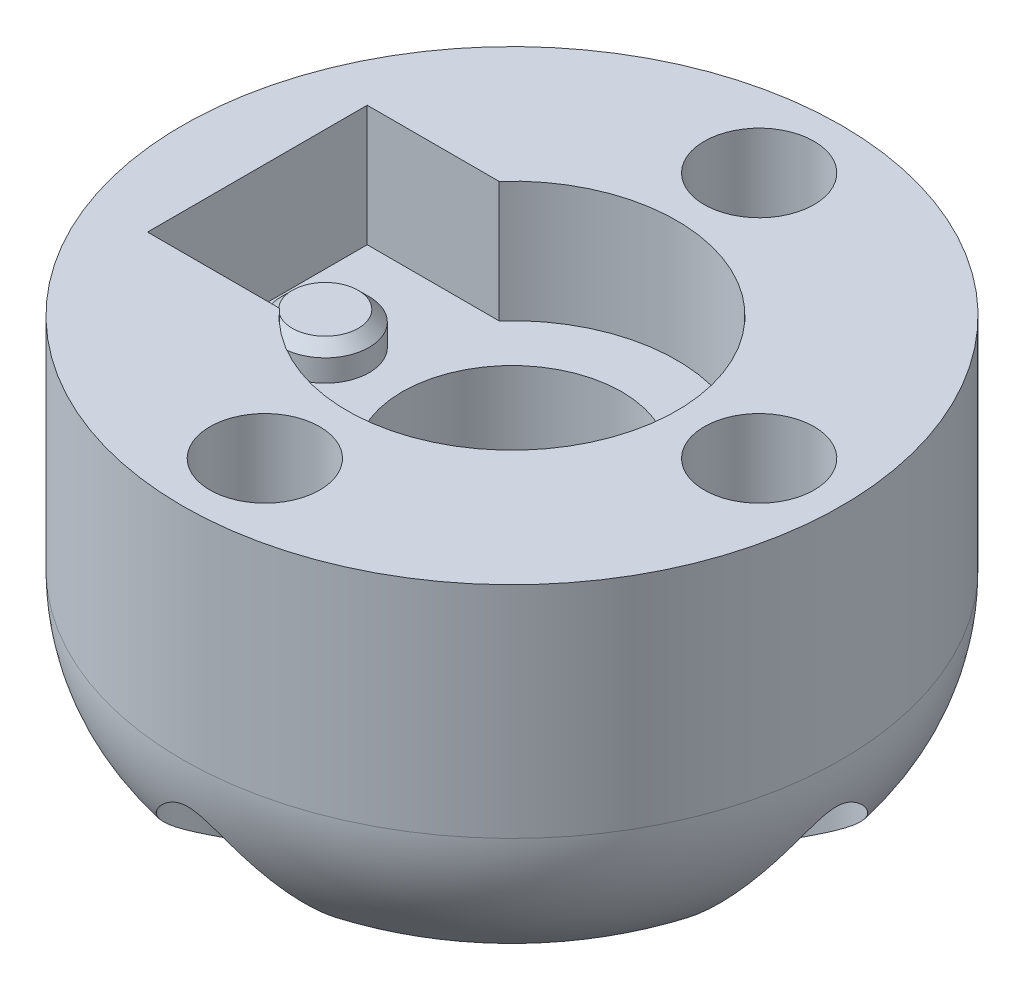
from build123d import *

# Parameters (mm, degrees)
SKETCH1_R             = 15
SKETCH1_R_2           = 5
BOSS_EXTRUDE1_DEPTH   = 7.5
SKETCH2_R             = 15
SKETCH2_R_2           = 7.5
BOSS_EXTRUDE2_DEPTH   = 5.5
BOSS_EXTRUDE3_START   = 5
SKETCH3_R             = 15
BOSS_EXTRUDE3_DEPTH   = 5
M4X0_7_TAPPED_HOLE1_D = 3.3
FILLET1_R             = 8
HOLE1_D               = 5
HOLE1_DEPTH           = 18
HOLE1_CBORE_D         = 7
HOLE1_CBORE_DEPTH     = 7
HOLE1_TIP             = 1.502151548
CUT_EXTRUDE1_START    = -5.5
CUT_EXTRUDE1_DEPTH    = 5.5
SKETCH10_R            = 2
BOSS_EXTRUDE4_DEPTH   = 1.5
CHAMFER1_SIZE         = 0.5


with BuildPart() as part:
    # Sketch1 → Boss-Extrude1 (new body)
    with BuildSketch(Plane(origin=(0, 0, 0), x_dir=(1, 0, 0), z_dir=(0, 1, 0))):
        with Locations(Location((0, 0, 0), (0, 0, 270))):
            Circle(SKETCH1_R)
        with Locations(Location((0, 0, 0), (0, 0, 270))):
            Circle(SKETCH1_R_2, mode=Mode.SUBTRACT)
    extrude(amount=BOSS_EXTRUDE1_DEPTH)

    # Sketch2 → Boss-Extrude2 (add)
    with BuildSketch(Plane(origin=(0, 7.5, 0), x_dir=(1, 0, 0), z_dir=(0, 1, 0))):
        with Locations(Location((0, 0, 0), (0, 0, 270))):
            Circle(SKETCH2_R)
        with Locations(Location((0, 0, 0), (0, 0, 270))):
            Circle(SKETCH2_R_2, mode=Mode.SUBTRACT)
    extrude(amount=BOSS_EXTRUDE2_DEPTH)

    # Sketch3 → Boss-Extrude3 (add)
    with BuildSketch(Plane.XZ.offset(BOSS_EXTRUDE3_START)):
        with Locations(Location((0, 0, 0), (0, 0, 270))):
            Circle(SKETCH3_R)
    extrude(amount=-BOSS_EXTRUDE3_DEPTH)

    # M4x0.7 Tapped Hole1 (through all)
    with Locations(Plane(origin=(0, -5, 0), x_dir=(-1, 0, 0), z_dir=(0, -1, 0))):
        with Locations((0, 0)):
            Hole(M4X0_7_TAPPED_HOLE1_D / 2)

    # Fillet1
    fillet1_edges = [part.edges().sort_by_distance(p)[0] for p in [
        (0, -5, 15),
    ]]
    fillet(fillet1_edges, radius=FILLET1_R)

    # Hole1
    with Locations(Plane(origin=(0, -5, 0), x_dir=(-1, 0, 0), z_dir=(0, -1, 0))):
        with Locations((0, 11.25), (-11.25, 0), (0, -11.25)):
            CounterBoreHole(HOLE1_D / 2, HOLE1_CBORE_D / 2, HOLE1_CBORE_DEPTH, depth=HOLE1_DEPTH)
            with Locations((0, 0, -(HOLE1_DEPTH + HOLE1_TIP / 2))):  # 118° drill point
                Cone(0, HOLE1_D / 2, HOLE1_TIP, mode=Mode.SUBTRACT)

    # Sketch9 → Cut-Extrude1 (cut)
    with BuildSketch(Plane(origin=(0, 13, 0), x_dir=(1, 0, 0), z_dir=(0, 1, 0)).offset(CUT_EXTRUDE1_START)):
        with BuildLine():
            Line((-5.590169944, 5), (-11.590169944, 5))
            Line((-11.590169944, 5), (-11.590169944, -5))
            Line((-11.590169944, -5), (-5.590169944, -5))
            ThreePointArc((-5.590169944, -5), (-7.5, 0), (-5.590169944, 5))
        make_face()
    extrude(amount=CUT_EXTRUDE1_DEPTH, mode=Mode.SUBTRACT)

    # Sketch10 → Boss-Extrude4 (add)
    with BuildSketch(Plane(origin=(0, 7.5, 0), x_dir=(1, 0, 0), z_dir=(0, 1, 0))):
        with Locations(Location((-8.5, 0, 0), (0, 0, 270))):
            Circle(SKETCH10_R)
    extrude(amount=BOSS_EXTRUDE4_DEPTH)

    # Chamfer1
    chamfer1_edges = [part.edges().sort_by_distance(p)[0] for p in [
        (-8.5, 9, -2),
    ]]
    chamfer(chamfer1_edges, length=CHAMFER1_SIZE)


solid = part.part
